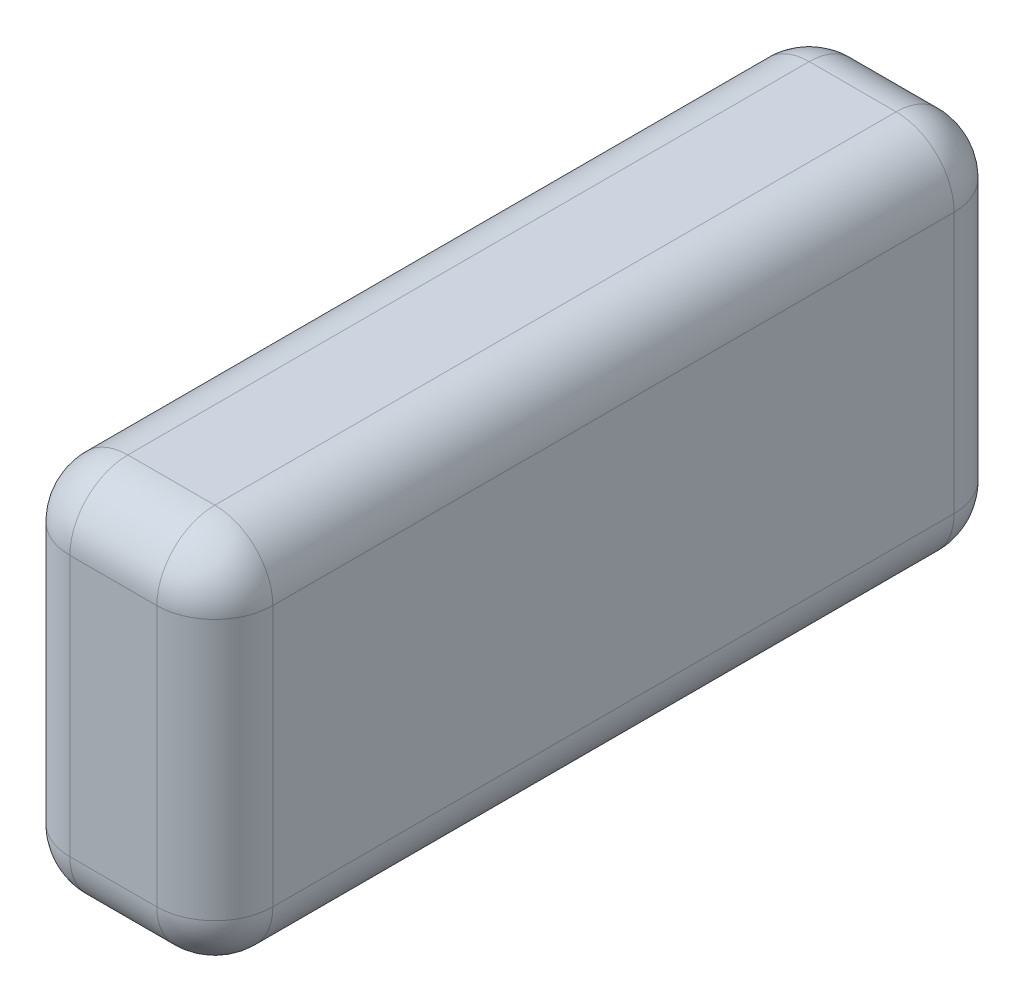
from build123d import *

# Parameters (mm, degrees)
SKETCH_1_W      = 28
SKETCH_1_H      = 52
EXTRUDE_1_DEPTH = 110
FILLET_1_R      = 8


with BuildPart() as part:
    # ｽｹｯﾁ1 → ﾎﾞｽ - 押し出し1 (new body)
    with BuildSketch(Plane.XY):
        Rectangle(SKETCH_1_W, SKETCH_1_H)
    extrude(amount=EXTRUDE_1_DEPTH)

    # ﾌｨﾚｯﾄ1
    fillet_1_edges = [part.edges().sort_by_distance(p)[0] for p in [
        (14, 0, 110),
        (0, 26, 110),
        (-14, 0, 110),
        (0, 26, 0),
        (14, 0, 0),
        (0, -26, 0),
        (-14, 0, 0),
        (-14, 26, 55),
        (14, 26, 55),
        (14, -26, 55),
        (-14, -26, 55),
        (0, -26, 110),
    ]]
    fillet(fillet_1_edges, radius=FILLET_1_R)


solid = part.part
